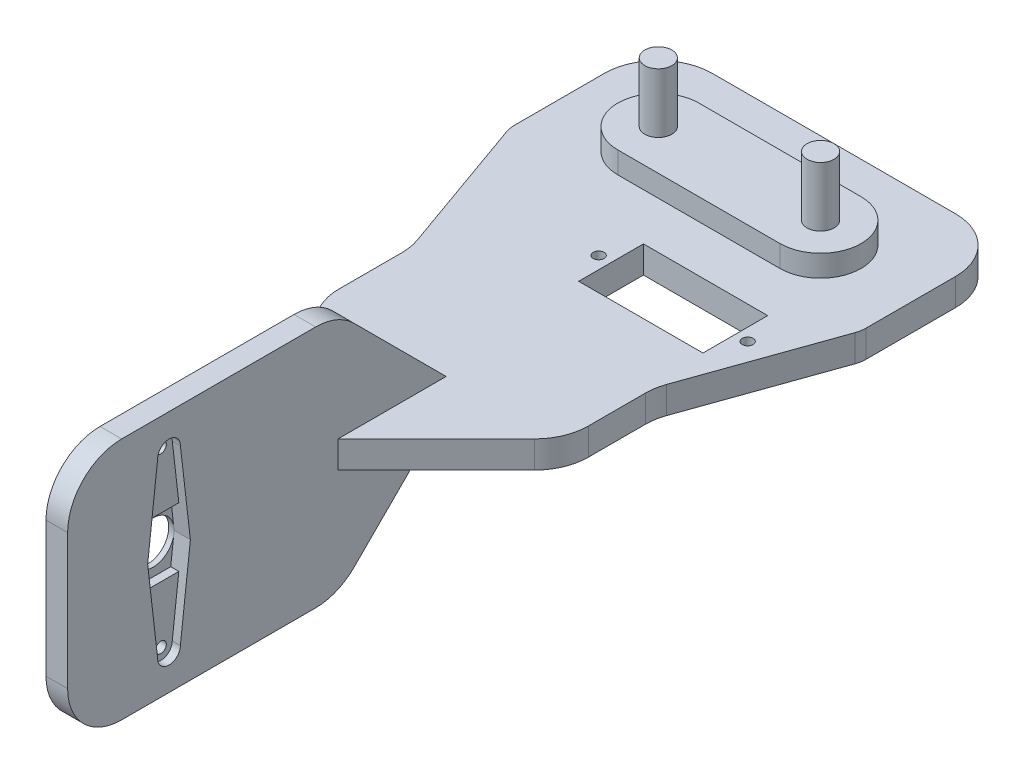
from build123d import *

# Parameters (mm, degrees)
SKETCH1_R           = 1
SKETCH1_W           = 22.98
SKETCH1_H           = 11.98
BOSS_EXTRUDE1_DEPTH = 5
SKETCH1_3_R         = 2.5
BOSS_EXTRUDE2_DEPTH = 9
SKETCH1_4_R         = 2.5
BOSS_EXTRUDE3_DEPTH = 20
SKETCH2_W           = 4
SKETCH2_H           = 45
BOSS_EXTRUDE4_DEPTH = 50
CUT_EXTRUDE1_DEPTH  = 123.24008033
RIB8_REACH          = 124.24
SKETCH7_WALL_W      = 274.764431908
SKETCH7_WALL_H      = 4
CUT_EXTRUDE2_DEPTH  = 3
SKETCH8_3_R         = 1
CUT_EXTRUDE3_DEPTH  = 123.469440072
FILLET1_R           = 10
SKETCH8_4_R         = 1
CUT_EXTRUDE4_DEPTH  = 1.5
SKETCH9_R           = 3.95
CUT_EXTRUDE5_DEPTH  = 10


with BuildPart() as part:
    # Sketch1 → Boss-Extrude1 (new body)
    with BuildSketch(Plane(origin=(0, 0, 0), x_dir=(1, 0, 0), z_dir=(0, 1, 0))):
        with BuildLine():
            Line((-31.918854571, 1.553979184), (-31.918854571, 18.1625))
            ThreePointArc((-31.918854571, 18.1625), (-28.989922383, 25.233567812), (-21.918854571, 28.1625))
            Line((-21.918854571, 28.1625), (23.081145429, 28.1625))
            ThreePointArc((23.081145429, 28.1625), (30.152213241, 25.233567812), (33.081145429, 18.1625))
            Line((33.081145429, 18.1625), (33.081145429, 1.553979184))
            ThreePointArc((33.081145429, 1.553979184), (33.006006891, 0.67544752), (32.782773845, -0.177565195))
            Line((32.782773845, -0.177565195), (23.081145429, -27.4925))
            Line((23.081145429, -27.4925), (23.081145429, -64.9925))
            Line((23.081145429, -64.9925), (-21.918854571, -64.9925))
            Line((-21.918854571, -64.9925), (-21.918854571, -27.4925))
            Line((-21.918854571, -27.4925), (-31.620482987, -0.177565195))
            ThreePointArc((-31.620482987, -0.177565195), (-31.843716032, 0.67544752), (-31.918854571, 1.553979184))
        make_face()
        with Locations(Location((-3.283854571, -11.5025, 0), (0, 0, 270))):
            Circle(SKETCH1_R, mode=Mode.SUBTRACT)
        with Locations(Location((24.276145429, -11.5025, 0), (0, 0, 270))):
            Circle(SKETCH1_R, mode=Mode.SUBTRACT)
        with Locations((10.496145429, -11.5025)):
            Rectangle(SKETCH1_W, SKETCH1_H, mode=Mode.SUBTRACT)
        with BuildLine():
            Line((15.581145429, 18.1625), (-14.418854571, 18.1625))
            ThreePointArc((-14.418854571, 18.1625), (-21.918854571, 10.6625), (-14.418854571, 3.1625))
            Line((-14.418854571, 3.1625), (15.581145429, 3.1625))
            ThreePointArc((15.581145429, 3.1625), (23.081145429, 10.6625), (15.581145429, 18.1625))
        make_face(mode=Mode.SUBTRACT)
    extrude(amount=BOSS_EXTRUDE1_DEPTH)

    # Sketch1<3> → Boss-Extrude2 (add)
    with BuildSketch(Plane(origin=(0, 0, 0), x_dir=(1, 0, 0), z_dir=(0, 1, 0))):
        with BuildLine():
            ThreePointArc((15.581145429, 18.1625), (23.081145429, 10.6625), (15.581145429, 3.1625))
            Line((15.581145429, 3.1625), (-14.418854571, 3.1625))
            ThreePointArc((-14.418854571, 3.1625), (-21.918854571, 10.6625), (-14.418854571, 18.1625))
            Line((-14.418854571, 18.1625), (15.581145429, 18.1625))
        make_face()
        with Locations(Location((-14.418854571, 10.6625, 0), (0, 0, 270))):
            Circle(SKETCH1_3_R, mode=Mode.SUBTRACT)
        with Locations(Location((15.581145429, 10.6625, 0), (0, 0, 270))):
            Circle(SKETCH1_3_R, mode=Mode.SUBTRACT)
    extrude(amount=BOSS_EXTRUDE2_DEPTH)

    # Sketch1<4> → Boss-Extrude3 (add)
    with BuildSketch(Plane(origin=(0, 0, 0), x_dir=(1, 0, 0), z_dir=(0, 1, 0))):
        with Locations(Location((15.581145429, 10.6625, 0), (0, 0, 270))):
            Circle(SKETCH1_4_R)
        with Locations(Location((-14.418854571, 10.6625, 0), (0, 0, 270))):
            Circle(SKETCH1_4_R)
    extrude(amount=BOSS_EXTRUDE3_DEPTH)

    # Sketch2 → Boss-Extrude4 (add)
    with BuildSketch(Plane.XY.offset(64.9925)):
        with Locations((0, 2.5)):
            Rectangle(SKETCH2_W, SKETCH2_H)
    extrude(amount=BOSS_EXTRUDE4_DEPTH)

    # Sketch6 → Cut-Extrude1 (cut, through all)
    with BuildSketch(Plane(origin=(0, 5, 0), x_dir=(1, 0, 0), z_dir=(0, 1, 0))):
        Polygon((-2, -64.9925), (-21.918854571, -45.073645429), (-21.918854571, -64.9925), align=None)
        Polygon((2, -64.9925), (23.081145429, -43.911354571), (23.081145429, -64.9925), align=None)
    extrude(amount=-CUT_EXTRUDE1_DEPTH, mode=Mode.SUBTRACT)

    # Sketch7 wall → Rib8 (add, up to next)
    with BuildSketch(Plane(origin=(0, 15, 54.9925), x_dir=(0, -0.707106781187, -0.707106781187), z_dir=(0, 0.707106781187, -0.707106781187)), mode=Mode.PRIVATE) as rib8_sk1:
        Rectangle(SKETCH7_WALL_W, SKETCH7_WALL_H)
    rib8_tool1 = extrude(rib8_sk1.sketch, amount=-RIB8_REACH, mode=Mode.PRIVATE) - part.part
    rib8 = rib8_tool1.solids().sort_by_distance((0, 15, 54.9925))[0]
    add(rib8)

    # Mirror2: Rib8 across plane
    add(rib8.mirror(Plane.ZX.offset(2.5)))

    # Sketch8 → Cut-Extrude2 (cut)
    with BuildSketch(Plane(origin=(2, 0, 0), x_dir=(0, 0, -1), z_dir=(1, 0, 0))):
        Polygon((-92.9284375, 8), (-99.5565625, 8), (-100.088277159, 3.401386734), (-100.1925, 2.5), (-100.088277159, 1.598613266), (-99.5565625, -3), (-92.9284375, -3), (-92.396722841, 1.598613266), (-92.2925, 2.5), (-92.396722841, 3.401386734), align=None)
    extrude(amount=-CUT_EXTRUDE2_DEPTH, mode=Mode.SUBTRACT)

    # Sketch8<3> → Cut-Extrude3 (cut, through all)
    with BuildSketch(Plane(origin=(2, 0, 0), x_dir=(0, 0, -1), z_dir=(1, 0, 0))):
        with Locations(Location((-96.2425, 18.5, 0), (0, 0, 90))):
            Circle(SKETCH8_3_R)
        with Locations(Location((-96.2425, -13.5, 0), (0, 0, 90))):
            Circle(SKETCH8_3_R)
    extrude(amount=-CUT_EXTRUDE3_DEPTH, mode=Mode.SUBTRACT)

    # Fillet1
    fillet1_edges = [part.edges().sort_by_distance(p)[0] for p in [
        (0, 25, 64.9925),
        (0, 25, 114.9925),
        (0, -20, 64.9925),
        (0, -20, 114.9925),
        (-21.918854571, 2.5, 45.073645429),
        (23.081145429, 2.5, 43.911354571),
        (23.081145429, 2.5, 27.4925),
        (-21.918854571, 2.5, 27.4925),
    ]]
    fillet(fillet1_edges, radius=FILLET1_R)

    # Sketch8<4> → Cut-Extrude4 (cut)
    # profile 1 of 2: a face of its own
    with BuildSketch(Plane(origin=(2, 0, 0), x_dir=(0, 0, -1), z_dir=(1, 0, 0))):
        with BuildLine():
            ThreePointArc((-94.1425, 18.5), (-96.2425, 20.6), (-98.3425, 18.5))
            Line((-98.3425, 18.5), (-99.5565625, 8))
            Line((-99.5565625, 8), (-92.9284375, 8))
            Line((-92.9284375, 8), (-94.1425, 18.5))
        make_face()
        with Locations(Location((-96.2425, 18.5, 0), (0, 0, 90))):
            Circle(SKETCH8_4_R, mode=Mode.SUBTRACT)
    # profile 2 of 2: a face of its own
    with BuildSketch(Plane(origin=(2, 0, 0), x_dir=(0, 0, -1), z_dir=(1, 0, 0))):
        with BuildLine():
            Line((-92.9284375, -3), (-99.5565625, -3))
            Line((-99.5565625, -3), (-98.3425, -13.5))
            ThreePointArc((-98.3425, -13.5), (-96.2425, -15.6), (-94.1425, -13.5))
            Line((-94.1425, -13.5), (-92.9284375, -3))
        make_face()
        with Locations(Location((-96.2425, -13.5, 0), (0, 0, 90))):
            Circle(SKETCH8_4_R, mode=Mode.SUBTRACT)
    extrude(amount=-CUT_EXTRUDE4_DEPTH, mode=Mode.SUBTRACT)

    # Sketch9 → Cut-Extrude5 (cut)
    with BuildSketch(Plane(origin=(-1, 0, 0), x_dir=(0, 0, -1), z_dir=(1, 0, 0))):
        with Locations(Location((-96.2425, 2.5, 0), (0, 0, 90))):
            Circle(SKETCH9_R)
    extrude(amount=-CUT_EXTRUDE5_DEPTH, mode=Mode.SUBTRACT)


solid = part.part
